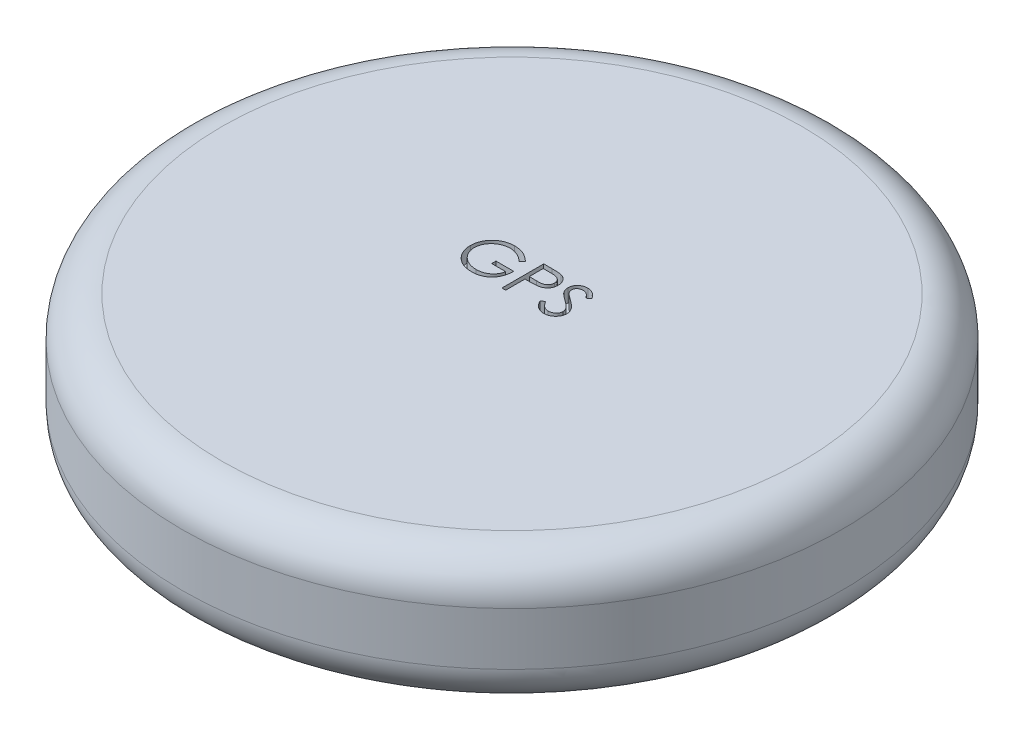
from build123d import *

# Parameters (mm, degrees)
SKETCH2_R           = 25
BOSS_EXTRUDE1_DEPTH = 10
FILLET1_R           = 3
SKETCH3_W           = 28.25
SKETCH3_H           = 28.25
BOSS_EXTRUDE2_DEPTH = 1
CUT_EXTRUDE1_DEPTH  = 1


with BuildPart() as part:
    # Sketch2 → Boss-Extrude1 (new body)
    with BuildSketch(Plane(origin=(0, 0, 0), x_dir=(1, 0, 0), z_dir=(0, 1, 0))):
        with Locations(Location((0, 0, 0), (0, 0, 270))):
            Circle(SKETCH2_R)
    extrude(amount=BOSS_EXTRUDE1_DEPTH)

    # Fillet1
    fillet1_edges = [part.edges().sort_by_distance(p)[0] for p in [
        (0, 0, -25),
        (0, 10, -25),
    ]]
    fillet(fillet1_edges, radius=FILLET1_R)

    # Sketch3 → Boss-Extrude2 (add)
    with BuildSketch(Plane(origin=(0, 0, 0), x_dir=(-1, 0, 0), z_dir=(0, -1, 0))):
        Rectangle(SKETCH3_W, SKETCH3_H)
    extrude(amount=BOSS_EXTRUDE2_DEPTH)

    # Sketch4 → Cut-Extrude1 (cut)
    # profile 1 of 3: a face of its own
    with BuildSketch(Plane(origin=(0, 10, 0), x_dir=(1, 0, 0), z_dir=(0, 1, 0))):
        with BuildLine():
            Line((-1.621474359, 2.633112981), (-1.865705128, 2.401602564))
            add(Edge.make_bspline(
                [(-1.865705128, 2.401602564), (-1.90990012, 2.443177704), (-1.997236247, 2.525336601), (-2.13962161, 2.631935861), (-2.288178621, 2.723254395), (-2.442132101, 2.797555052), (-2.597669503, 2.856839342), (-2.752726322, 2.899047012), (-2.905712065, 2.925964242), (-3.007463756, 2.92918312), (-3.057602163, 2.930769231)],
                knots=[0, 0, 0, 0, 1.08915593, 2.152340314, 3.188132944, 4.216796309, 5.218260357, 6.173443236, 7.099959455, 8, 8, 8, 8], degree=3))
            add(Edge.make_bspline(
                [(-3.057602163, 2.930769231), (-3.088367641, 2.930394031), (-3.149818805, 2.929644605), (-3.241097283, 2.920079495), (-3.331418447, 2.906322797), (-3.420611794, 2.88641838), (-3.508850746, 2.86119159), (-3.595828413, 2.829636205), (-3.681707042, 2.792846805), (-3.765677701, 2.750335847), (-3.847085158, 2.703636272), (-3.923971716, 2.651885096), (-3.996827442, 2.596740979), (-4.064282971, 2.536823305), (-4.126726319, 2.47267482), (-4.18564377, 2.405488821), (-4.238963174, 2.33342973), (-4.287124445, 2.257823341), (-4.330088199, 2.179997569), (-4.368014621, 2.1007015), (-4.399852694, 2.020198146), (-4.425043557, 1.93838649), (-4.445826793, 1.855899455), (-4.460447765, 1.772165887), (-4.46869072, 1.687096129), (-4.470116549, 1.630130045), (-4.470833333, 1.601492388)],
                knots=[0, 0, 0, 0, 1.02818874, 2.053710826, 3.065248034, 4.081641283, 5.106893873, 6.131558223, 7.173050175, 8.228653731, 9.27666206, 10.308777013, 11.325269123, 12.329503258, 13.32196095, 14.316845687, 15.314881793, 16.315733098, 17.311955233, 18.285320748, 19.252783886, 20.203351036, 21.145449891, 22.095197417, 23.042428769, 24, 24, 24, 24], degree=3))
            add(Edge.make_bspline(
                [(-4.470833333, 1.601492388), (-4.470147789, 1.572218146), (-4.468778572, 1.513749602), (-4.460015282, 1.426487836), (-4.443751807, 1.340522078), (-4.422009671, 1.255569843), (-4.394812788, 1.17148564), (-4.360910441, 1.088634006), (-4.320755218, 1.007018008), (-4.274276346, 0.927373027), (-4.223307432, 0.849791427), (-4.166209066, 0.776712433), (-4.105556965, 0.707162899), (-4.039141499, 0.642687027), (-3.969092343, 0.581560207), (-3.893316635, 0.525466555), (-3.813304403, 0.473325596), (-3.728933576, 0.425794467), (-3.641119623, 0.383332438), (-3.551079568, 0.345573618), (-3.458525764, 0.314477362), (-3.36394461, 0.289133511), (-3.267448856, 0.26835967), (-3.168548692, 0.254995206), (-3.067971307, 0.245297095), (-3.000172691, 0.244588008), (-2.966015625, 0.244230769)],
                knots=[0, 0, 0, 0, 0.93586088, 1.869166235, 2.799637598, 3.729985548, 4.670839027, 5.622275134, 6.589130586, 7.576015415, 8.568469353, 9.55398029, 10.53834874, 11.515998671, 12.510579167, 13.508179873, 14.527009472, 15.561807829, 16.601455013, 17.643573243, 18.680854198, 19.719860599, 20.772568776, 21.833555941, 22.908541556, 24, 24, 24, 24], degree=3))
            add(Edge.make_bspline(
                [(-2.966015625, 0.244230769), (-2.924850981, 0.245091263), (-2.844017516, 0.246780984), (-2.7251941, 0.259934818), (-2.611072743, 0.280478695), (-2.501974116, 0.310564901), (-2.397771504, 0.348940378), (-2.298082907, 0.395200478), (-2.203693188, 0.451119539), (-2.114318595, 0.514232975), (-2.031988863, 0.584550002), (-1.957735479, 0.660427472), (-1.892742785, 0.741497075), (-1.836042093, 0.827281326), (-1.789134957, 0.918490281), (-1.750633279, 1.014676963), (-1.721120936, 1.115884634), (-1.709006065, 1.185817757), (-1.702884615, 1.221153846)],
                knots=[0, 0, 0, 0, 1.13008108, 2.219097802, 3.278683437, 4.311054135, 5.322181354, 6.324827112, 7.324222904, 8.330512327, 9.32562643, 10.293043162, 11.24128371, 12.174520618, 13.111833804, 14.052305215, 15.015860969, 16, 16, 16, 16], degree=3))
            Line((-1.702884615, 1.221153846), (-2.761217949, 1.221153846))
            Line((-2.761217949, 1.221153846), (-2.761217949, 1.546794872))
            Line((-2.761217949, 1.546794872), (-1.417948718, 1.546794872))
            add(Edge.make_bspline(
                [(-1.417948718, 1.546794872), (-1.419496166, 1.486100221), (-1.422524802, 1.367309826), (-1.443769104, 1.194072509), (-1.478074083, 1.030449616), (-1.524937366, 0.876268829), (-1.585602799, 0.731748642), (-1.659419306, 0.59674232), (-1.747568302, 0.472122045), (-1.846909917, 0.356870449), (-1.958397736, 0.254064664), (-2.079019269, 0.163707849), (-2.208973805, 0.087596191), (-2.348138416, 0.025674018), (-2.496057524, -0.022653106), (-2.653073411, -0.056917322), (-2.818973149, -0.077445931), (-2.93267142, -0.080068825), (-2.990820313, -0.081410256)],
                knots=[0, 0, 0, 0, 1.140356446, 2.231883559, 3.274166699, 4.278491846, 5.25512956, 6.21435461, 7.1637429, 8.11826594, 9.068280886, 10.0076534, 10.945064095, 11.891975133, 12.864533718, 13.863980011, 14.907571808, 16, 16, 16, 16], degree=3))
            add(Edge.make_bspline(
                [(-2.990820313, -0.081410256), (-3.02666165, -0.080893982), (-3.097352318, -0.079875723), (-3.201756231, -0.072639129), (-3.303281501, -0.061498892), (-3.401913338, -0.044675816), (-3.498014548, -0.02407038), (-3.591105172, 0.00231543), (-3.681539823, 0.03285775), (-3.769458282, 0.067597396), (-3.854062549, 0.107848828), (-3.935729461, 0.152579715), (-4.014910447, 0.201559407), (-4.091066146, 0.25563496), (-4.16459336, 0.314401906), (-4.235017984, 0.377978032), (-4.302734273, 0.446168976), (-4.345152694, 0.494591364), (-4.366526442, 0.518990385)],
                knots=[0, 0, 0, 0, 1.107784379, 2.184907829, 3.233506516, 4.263428166, 5.276301166, 6.270063455, 7.25232949, 8.225834625, 9.190232166, 10.146266622, 11.1027726, 12.066435141, 13.031522626, 14.010570082, 14.99756817, 16, 16, 16, 16], degree=3))
            add(Edge.make_bspline(
                [(-4.366526442, 0.518990385), (-4.397537966, 0.557698763), (-4.459046255, 0.634473), (-4.538220011, 0.757481521), (-4.605712712, 0.884846065), (-4.660474951, 1.016921192), (-4.703235929, 1.153583364), (-4.73390303, 1.29465795), (-4.751871071, 1.440326615), (-4.754459637, 1.538901533), (-4.755769231, 1.588772035)],
                knots=[0, 0, 0, 0, 1.023165419, 2.029347347, 3.013907458, 3.994755782, 4.975994455, 5.96558838, 6.970761222, 8, 8, 8, 8], degree=3))
            add(Edge.make_bspline(
                [(-4.755769231, 1.588772035), (-4.755286415, 1.626115707), (-4.754326919, 1.700328436), (-4.742692344, 1.810507565), (-4.725999629, 1.918730336), (-4.701464086, 2.024908283), (-4.670533903, 2.12911232), (-4.631931812, 2.23139083), (-4.586987514, 2.331804171), (-4.534749242, 2.42966118), (-4.476615483, 2.523663326), (-4.413523497, 2.61343219), (-4.344577374, 2.697332985), (-4.270903042, 2.776428266), (-4.191621486, 2.849724363), (-4.107475438, 2.917899877), (-4.018400048, 2.98104626), (-3.924115085, 3.038168896), (-3.826027828, 3.08948018), (-3.724373398, 3.134464679), (-3.619182826, 3.171642401), (-3.511244186, 3.203187187), (-3.399740453, 3.226514493), (-3.285480788, 3.243431569), (-3.167869614, 3.255007256), (-3.088371216, 3.255938217), (-3.048061899, 3.256410256)],
                knots=[0, 0, 0, 0, 1.008945113, 2.00506715, 2.99143336, 3.967273523, 4.948097931, 5.927297278, 6.919902385, 7.919676788, 8.923139349, 9.905703106, 10.883022732, 11.856032218, 12.825136022, 13.798837087, 14.781400844, 15.773989409, 16.776158564, 17.77167057, 18.775803737, 19.789618931, 20.80898985, 21.851988756, 22.910860228, 24, 24, 24, 24], degree=3))
            add(Edge.make_bspline(
                [(-3.048061899, 3.256410256), (-3.015188635, 3.255884575), (-2.950004816, 3.254842209), (-2.853007902, 3.247617136), (-2.757510238, 3.236165472), (-2.663370227, 3.220538316), (-2.570908452, 3.199253397), (-2.479861512, 3.173782381), (-2.390097426, 3.144126228), (-2.301897514, 3.108757774), (-2.214668729, 3.068613415), (-2.127926059, 3.023425524), (-2.041965886, 2.972421413), (-1.956639139, 2.915449634), (-1.871407753, 2.853488677), (-1.787619828, 2.784766415), (-1.703252871, 2.711992915), (-1.649004083, 2.659666934), (-1.621474359, 2.633112981)],
                knots=[0, 0, 0, 0, 0.985871117, 1.954866573, 2.915460327, 3.869826059, 4.81536089, 5.759505086, 6.70452669, 7.649098992, 8.607881297, 9.583363685, 10.581137262, 11.603961102, 12.659522466, 13.73993555, 14.853081303, 16, 16, 16, 16], degree=3))
        make_face()
    # profile 2 of 3: a face of its own
    with BuildSketch(Plane(origin=(0, 10, 0), x_dir=(1, 0, 0), z_dir=(0, 1, 0))):
        with BuildLine():
            Line((-0.766666667, 3.175), (-0.144005409, 3.175))
            add(Edge.make_bspline(
                [(-0.144005409, 3.175), (-0.101178372, 3.174952923), (-0.019119869, 3.17486272), (0.098550217, 3.172127915), (0.205420474, 3.16847513), (0.301260462, 3.163411556), (0.386365066, 3.157427506), (0.460349187, 3.149034585), (0.523794356, 3.140271317), (0.561809493, 3.131361898), (0.579146635, 3.127298678)],
                knots=[0, 0, 0, 0, 1.415646017, 2.712440637, 3.8905458, 4.950247383, 5.884950622, 6.709939814, 7.411656543, 8, 8, 8, 8], degree=3))
            add(Edge.make_bspline(
                [(0.579146635, 3.127298678), (0.601093626, 3.121291623), (0.644470455, 3.109419063), (0.706973544, 3.085639471), (0.766440247, 3.057443507), (0.823074589, 3.025308933), (0.876180622, 2.987857028), (0.926550673, 2.946605961), (0.973740227, 2.900603324), (1.017483918, 2.850365081), (1.057656556, 2.796734605), (1.092245625, 2.738911296), (1.121208181, 2.677868471), (1.14604872, 2.613648589), (1.163927104, 2.545712367), (1.177395363, 2.474531849), (1.18594394, 2.400114666), (1.186762692, 2.349260357), (1.187179487, 2.323372396)],
                knots=[0, 0, 0, 0, 0.999701418, 1.975846123, 2.934577507, 3.890451536, 4.834027766, 5.787354733, 6.749476667, 7.726910423, 8.712836071, 9.690891519, 10.682875813, 11.679750201, 12.712814741, 13.765529915, 14.8625177, 16, 16, 16, 16], degree=3))
            add(Edge.make_bspline(
                [(1.187179487, 2.323372396), (1.186797195, 2.297266841), (1.186049214, 2.24618956), (1.177071869, 2.171465674), (1.164979481, 2.100056849), (1.146385727, 2.032121418), (1.122032866, 1.968062827), (1.093465075, 1.906902138), (1.059008587, 1.849679864), (1.019416491, 1.796188264), (0.975373259, 1.74637713), (0.927065237, 1.700607423), (0.87468745, 1.659147059), (0.818406359, 1.62190309), (0.757673281, 1.589739179), (0.693409328, 1.560930767), (0.625055917, 1.536736305), (0.577755208, 1.524009035), (0.553705929, 1.517538061)],
                knots=[0, 0, 0, 0, 1.121902311, 2.195077645, 3.232258892, 4.234102512, 5.217864754, 6.176164875, 7.132989551, 8.084763148, 9.034132444, 9.988522005, 10.94243251, 11.903244335, 12.886203696, 13.894208494, 14.929344452, 16, 16, 16, 16], degree=3))
            add(Edge.make_bspline(
                [(0.553705929, 1.517538061), (0.533814705, 1.513308071), (0.49022193, 1.504037802), (0.418428175, 1.493688702), (0.334839146, 1.484855307), (0.239568935, 1.478232132), (0.132703057, 1.472562155), (0.014183703, 1.468055384), (-0.116221782, 1.465579017), (-0.207182125, 1.465451298), (-0.254672476, 1.465384615)],
                knots=[0, 0, 0, 0, 0.601384939, 1.31797006, 2.144135048, 3.087295005, 4.142315834, 5.309527816, 6.595305764, 8, 8, 8, 8], degree=3))
            Line((-0.254672476, 1.465384615), (-0.481730769, 1.465384615))
            Line((-0.481730769, 1.465384615), (-0.481730769, 0))
            Line((-0.481730769, 0), (-0.766666667, 0))
            Line((-0.766666667, 0), (-0.766666667, 3.175))
        make_face()
        with BuildLine():
            Line((-0.481730769, 2.849358974), (-0.481730769, 1.791025641))
            Line((-0.481730769, 1.791025641), (0.074148638, 1.784029447))
            add(Edge.make_bspline(
                [(0.074148638, 1.784029447), (0.101290285, 1.784015419), (0.153686675, 1.783988339), (0.229375249, 1.787603506), (0.299596531, 1.791776847), (0.364134824, 1.797887291), (0.423019222, 1.806524432), (0.476347909, 1.815243652), (0.523707372, 1.827857802), (0.579133077, 1.8448423), (0.640894399, 1.873809745), (0.708084247, 1.915855716), (0.765026136, 1.969450359), (0.814300591, 2.029709891), (0.85340378, 2.096746959), (0.882029573, 2.16847378), (0.898849052, 2.244154758), (0.901104384, 2.295941855), (0.90224359, 2.322100361)],
                knots=[0, 0, 0, 0, 1.160613943, 2.240541288, 3.23993089, 4.169200891, 5.011653406, 5.7853311, 6.478053781, 7.106038997, 8.262395093, 9.384106736, 10.481365981, 11.59014053, 12.70357646, 13.786202915, 14.881775077, 16, 16, 16, 16], degree=3))
            add(Edge.make_bspline(
                [(0.90224359, 2.322100361), (0.901098189, 2.347626012), (0.898821274, 2.398367848), (0.881897741, 2.472734295), (0.853459435, 2.543705256), (0.814038096, 2.609902269), (0.766194356, 2.669944969), (0.710587095, 2.722103078), (0.647347208, 2.764032765), (0.588520598, 2.791095813), (0.536268094, 2.80761967), (0.490881959, 2.819181061), (0.439636847, 2.82841179), (0.382516076, 2.835886196), (0.319962376, 2.842284693), (0.251438334, 2.846626258), (0.177203529, 2.849167579), (0.125668225, 2.849293631), (0.098953325, 2.849358974)],
                knots=[0, 0, 0, 0, 1.120700087, 2.227813068, 3.331159281, 4.466773991, 5.599788987, 6.693661531, 7.80175334, 8.91857717, 9.525282508, 10.207424825, 10.974604443, 11.810962634, 12.737642355, 13.736264703, 14.826523623, 16, 16, 16, 16], degree=3))
            Line((0.098953325, 2.849358974), (-0.481730769, 2.849358974))
        make_face(mode=Mode.SUBTRACT)
    # profile 3 of 3: a face of its own
    with BuildSketch(Plane(origin=(0, 10, 0), x_dir=(1, 0, 0), z_dir=(0, 1, 0))):
        with BuildLine():
            Line((1.512820513, 0.612484976), (1.781219952, 0.773397436))
            add(Edge.make_bspline(
                [(1.781219952, 0.773397436), (1.806182924, 0.731610458), (1.854011016, 0.651548221), (1.933795463, 0.543364142), (2.016466033, 0.451414185), (2.102634928, 0.376233263), (2.191776181, 0.317043201), (2.284471715, 0.275131177), (2.380409158, 0.24899097), (2.445699696, 0.245815892), (2.478295272, 0.244230769)],
                knots=[0, 0, 0, 0, 1.272034388, 2.437168799, 3.508375237, 4.49857839, 5.41946034, 6.295179144, 7.148887113, 8, 8, 8, 8], degree=3))
            add(Edge.make_bspline(
                [(2.478295272, 0.244230769), (2.506132639, 0.245006079), (2.561320283, 0.246543133), (2.642566032, 0.261312147), (2.721470952, 0.284001721), (2.796408788, 0.316496423), (2.866345524, 0.355810621), (2.927674455, 0.403296082), (2.980693429, 0.456460283), (3.024063126, 0.515771691), (3.057337158, 0.57955939), (3.082911391, 0.645033288), (3.097103708, 0.713221918), (3.09924162, 0.759132838), (3.100320513, 0.782301683)],
                knots=[0, 0, 0, 0, 1.095163259, 2.171163733, 3.241058638, 4.321873601, 5.38011039, 6.391990106, 7.366004449, 8.327778327, 9.272591725, 10.192022065, 11.087607919, 12, 12, 12, 12], degree=3))
            add(Edge.make_bspline(
                [(3.100320513, 0.782301683), (3.098983102, 0.808736596), (3.096264342, 0.862474913), (3.073285071, 0.941758884), (3.037136112, 1.020220001), (3.003787142, 1.068753292), (2.986473357, 1.093950321)],
                knots=[0, 0, 0, 0, 0.938893495, 1.908633276, 2.914225137, 4, 4, 4, 4], degree=3))
            add(Edge.make_bspline(
                [(2.986473357, 1.093950321), (2.972257872, 1.112135653), (2.942414238, 1.150313485), (2.891108494, 1.207141663), (2.830904947, 1.2657598), (2.763863865, 1.32840623), (2.687543135, 1.392167303), (2.604333175, 1.460083527), (2.512109532, 1.5295721), (2.447430703, 1.576174356), (2.414057492, 1.600220353)],
                knots=[0, 0, 0, 0, 0.722233717, 1.516239348, 2.393582979, 3.351407094, 4.387010283, 5.505090956, 6.712668013, 8, 8, 8, 8], degree=3))
            add(Edge.make_bspline(
                [(2.414057492, 1.600220353), (2.380652867, 1.624013428), (2.316785767, 1.669503978), (2.227469768, 1.737017435), (2.147600862, 1.798742946), (2.07753404, 1.855261585), (2.01730012, 1.90658102), (1.966424454, 1.952208436), (1.926203049, 1.993377809), (1.903836915, 2.020085312), (1.893795072, 2.032076322)],
                knots=[0, 0, 0, 0, 1.452282411, 2.77665338, 3.964542531, 5.026858415, 5.96415736, 6.766646006, 7.446254459, 8, 8, 8, 8], degree=3))
            add(Edge.make_bspline(
                [(1.893795072, 2.032076322), (1.879759263, 2.050764406), (1.852155961, 2.08751703), (1.815719656, 2.144961722), (1.784750559, 2.203765684), (1.7604733, 2.264086933), (1.74002973, 2.325078618), (1.726279322, 2.387536534), (1.717669269, 2.451180424), (1.716787538, 2.494009814), (1.716346154, 2.51544972)],
                knots=[0, 0, 0, 0, 1.068054152, 2.10047183, 3.106115577, 4.101338837, 5.06977816, 6.043150881, 7.020423561, 8, 8, 8, 8], degree=3))
            add(Edge.make_bspline(
                [(1.716346154, 2.51544972), (1.717530165, 2.549041015), (1.719872879, 2.615505616), (1.739685349, 2.712597869), (1.770957188, 2.805295548), (1.814767551, 2.892680922), (1.871243864, 2.972478633), (1.936599855, 3.045606582), (2.014443131, 3.107082367), (2.099853011, 3.160796163), (2.193339863, 3.202838538), (2.29130304, 3.234553141), (2.393898241, 3.252522968), (2.463388227, 3.255101762), (2.498647837, 3.256410256)],
                knots=[0, 0, 0, 0, 1.005424448, 1.989358655, 2.955360095, 3.929531133, 4.905563448, 5.876582895, 6.856512386, 7.866279853, 8.892233794, 9.918561126, 10.94386622, 12, 12, 12, 12], degree=3))
            add(Edge.make_bspline(
                [(2.498647837, 3.256410256), (2.536062128, 3.255119799), (2.610467211, 3.252553491), (2.719913285, 3.230240016), (2.825287649, 3.193318692), (2.910054039, 3.151418981), (2.976395902, 3.109571197), (3.026989738, 3.071453213), (3.078259139, 3.027570079), (3.130617661, 2.977804906), (3.183178116, 2.921701067), (3.236720819, 2.8596428), (3.291370977, 2.792009352), (3.326528079, 2.743727127), (3.344551282, 2.718975361)],
                knots=[0, 0, 0, 0, 1.286793592, 2.559021753, 3.825965368, 5.121522368, 5.803751409, 6.523245864, 7.299691795, 8.125521123, 9.008227632, 9.944561021, 10.946284179, 12, 12, 12, 12], degree=3))
            Line((3.344551282, 2.718975361), (3.086964143, 2.523717949))
            add(Edge.make_bspline(
                [(3.086964143, 2.523717949), (3.071410332, 2.543755546), (3.041457331, 2.582343275), (2.995982725, 2.636382968), (2.953121451, 2.685746489), (2.910893589, 2.728622712), (2.871529366, 2.767359647), (2.833323192, 2.80052457), (2.796824887, 2.828442431), (2.750817404, 2.858236232), (2.693016331, 2.887769632), (2.62045893, 2.912760581), (2.544634238, 2.927778387), (2.492990929, 2.929764021), (2.466846955, 2.930769231)],
                knots=[0, 0, 0, 0, 1.181633172, 2.275549214, 3.290209073, 4.226197932, 5.078386478, 5.862611352, 6.581680152, 7.217281963, 8.414376989, 9.595101626, 10.782541182, 12, 12, 12, 12], degree=3))
            add(Edge.make_bspline(
                [(2.466846955, 2.930769231), (2.434047824, 2.929670046), (2.37079779, 2.927550371), (2.280999504, 2.904400099), (2.200178586, 2.867949411), (2.130734474, 2.816863681), (2.07291593, 2.756338209), (2.031091693, 2.686688819), (2.005918329, 2.609779068), (2.00284649, 2.556129137), (2.001282051, 2.52880609)],
                knots=[0, 0, 0, 0, 1.14458467, 2.207223713, 3.21896685, 4.227309161, 5.202851033, 6.127160689, 7.046193047, 8, 8, 8, 8], degree=3))
            add(Edge.make_bspline(
                [(2.001282051, 2.52880609), (2.001638673, 2.51179582), (2.0023525, 2.477747465), (2.01230821, 2.427445104), (2.025098315, 2.377269817), (2.045366274, 2.327447189), (2.073347371, 2.277105877), (2.110091352, 2.225379015), (2.156367714, 2.17181068), (2.191816146, 2.136969705), (2.210531851, 2.11857472)],
                knots=[0, 0, 0, 0, 0.858281714, 1.717966888, 2.583508476, 3.4729293, 4.427298488, 5.488583878, 6.674047936, 8, 8, 8, 8], degree=3))
            add(Edge.make_bspline(
                [(2.210531851, 2.11857472), (2.21748181, 2.11237256), (2.233993323, 2.09763765), (2.264179341, 2.073514653), (2.304041736, 2.043757852), (2.35253959, 2.006939358), (2.410567126, 1.964229746), (2.478130723, 1.916175112), (2.554477256, 1.861215445), (2.608653566, 1.822791105), (2.637299679, 1.802473958)],
                knots=[0, 0, 0, 0, 0.420754252, 0.999615792, 1.744751191, 2.668019286, 3.750313428, 4.999500688, 6.413464383, 8, 8, 8, 8], degree=3))
            add(Edge.make_bspline(
                [(2.637299679, 1.802473958), (2.671758329, 1.777399296), (2.738482729, 1.728845689), (2.833422105, 1.655897179), (2.919504345, 1.584552418), (2.99703168, 1.515267017), (3.066770018, 1.448566533), (3.127945665, 1.383648505), (3.181181961, 1.320978021), (3.238494538, 1.240630042), (3.297057702, 1.141950058), (3.34735107, 1.021047656), (3.379063285, 0.899675279), (3.383210303, 0.818098792), (3.38525641, 0.777849559)],
                knots=[0, 0, 0, 0, 1.163667725, 2.253281268, 3.268753668, 4.215851969, 5.092017293, 5.902905408, 6.650798638, 7.335211899, 8.59617414, 9.77448103, 10.901945474, 12, 12, 12, 12], degree=3))
            add(Edge.make_bspline(
                [(3.38525641, 0.777849559), (3.384660292, 0.7493849), (3.383479632, 0.693008344), (3.369907946, 0.610226953), (3.350023678, 0.529826093), (3.320054187, 0.452799584), (3.283475322, 0.377738263), (3.237060226, 0.306611097), (3.183259684, 0.237843864), (3.12154334, 0.173270268), (3.054010271, 0.113991933), (2.98263292, 0.06126057), (2.907294458, 0.017292877), (2.828403585, -0.018585387), (2.745942179, -0.046646507), (2.659937975, -0.066978181), (2.570249204, -0.079456576), (2.509288768, -0.080751759), (2.478295272, -0.081410256)],
                knots=[0, 0, 0, 0, 0.983748083, 1.948392443, 2.894712957, 3.844097841, 4.80183111, 5.778335162, 6.776009319, 7.81870978, 8.863265674, 9.881300176, 10.883814829, 11.87499822, 12.874611388, 13.892143829, 14.928324115, 16, 16, 16, 16], degree=3))
            add(Edge.make_bspline(
                [(2.478295272, -0.081410256), (2.45431464, -0.080946542), (2.406655386, -0.080024952), (2.336161785, -0.071877648), (2.2670923, -0.06035049), (2.20031363, -0.042049726), (2.134965407, -0.019845611), (2.071331844, 0.007494162), (2.009382102, 0.040257623), (1.948769009, 0.07771811), (1.889646722, 0.12131335), (1.832569776, 0.172089307), (1.775665444, 0.228645587), (1.720613306, 0.292518026), (1.66629981, 0.362674716), (1.613795825, 0.439772046), (1.562014552, 0.523390074), (1.529524806, 0.582231974), (1.512820513, 0.612484976)],
                knots=[0, 0, 0, 0, 0.915332311, 1.819136955, 2.706846663, 3.586547465, 4.459518054, 5.340707479, 6.227863349, 7.133153174, 8.059268498, 9.028702269, 10.047606654, 11.120612155, 12.245963614, 13.433783089, 14.680604001, 16, 16, 16, 16], degree=3))
        make_face()
    extrude(amount=-CUT_EXTRUDE1_DEPTH, mode=Mode.SUBTRACT)


solid = part.part
